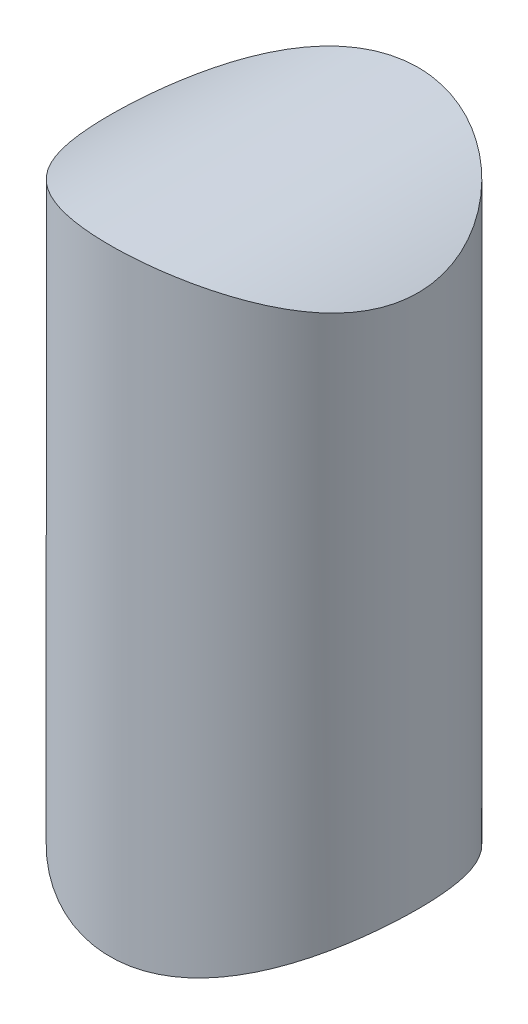
from build123d import *

# Parameters (mm, degrees)
SKETCH1_R           = 2
BOSS_EXTRUDE1_DEPTH = 20
SKETCH2_OUTSIDE_W   = 10.156
SKETCH2_OUTSIDE_H   = 26.156
SKETCH2_OUTSIDE_R   = 4
CUT_EXTRUDE2_DEPTH  = 10


with BuildPart() as part:
    # Sketch1 → Boss-Extrude1 (new body)
    with BuildSketch(Plane(origin=(0, 0, 0), x_dir=(1, 0, 0), z_dir=(0, 1, 0))):
        with Locations(Location((0, 0, 0), (0, 0, 270))):
            Circle(SKETCH1_R)
    extrude(amount=BOSS_EXTRUDE1_DEPTH)

    # Sketch2 outside → Cut-Extrude2 (cut, symmetric)
    with BuildSketch(Plane.XY):
        with Locations((0, 10)):
            Rectangle(SKETCH2_OUTSIDE_W, SKETCH2_OUTSIDE_H)
        with Locations((0, 10.912841677)):
            Circle(SKETCH2_OUTSIDE_R, mode=Mode.SUBTRACT)
    extrude(amount=CUT_EXTRUDE2_DEPTH, both=True, mode=Mode.SUBTRACT)


solid = part.part
